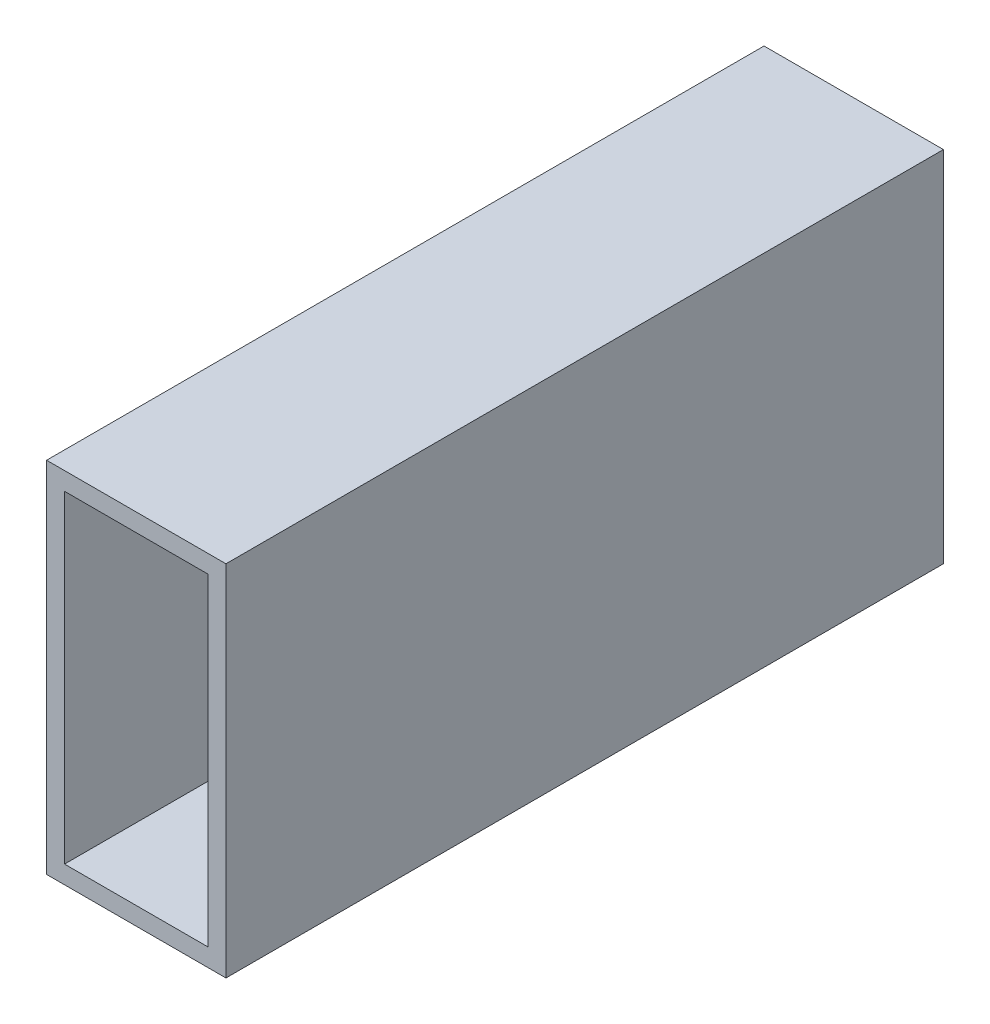
from build123d import *

# Parameters (mm, degrees)
SKETCH1_W           = 25
SKETCH1_H           = 50
SKETCH1_W_2         = 20
SKETCH1_H_2         = 45
BOSS_EXTRUDE1_DEPTH = 100


with BuildPart() as part:
    # Sketch1 → Boss-Extrude1 (new body)
    with BuildSketch(Plane.XY):
        Rectangle(SKETCH1_W, SKETCH1_H)
        Rectangle(SKETCH1_W_2, SKETCH1_H_2, mode=Mode.SUBTRACT)
    extrude(amount=BOSS_EXTRUDE1_DEPTH)


solid = part.part
